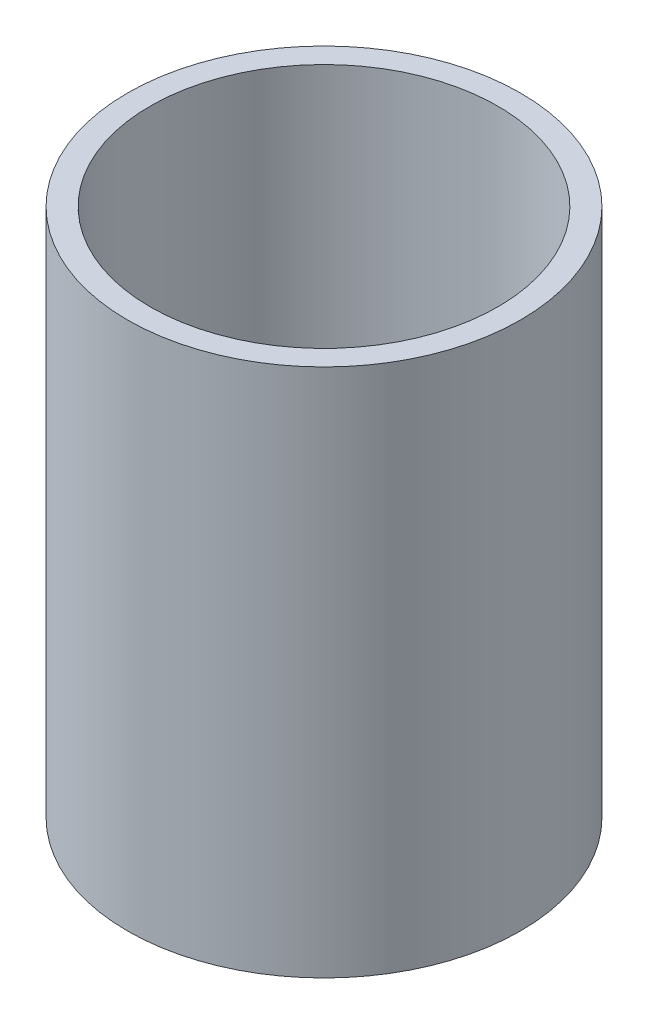
from build123d import *

# Parameters (mm, degrees)
SKETCH1_R           = 26
SKETCH1_R_2         = 23
BOSS_EXTRUDE1_DEPTH = 70


with BuildPart() as part:
    # Sketch1 → Boss-Extrude1 (new body)
    with BuildSketch(Plane(origin=(0, 0, 0), x_dir=(1, 0, 0), z_dir=(0, 1, 0))):
        with Locations(Location((0, 0, 0), (0, 0, 270))):
            Circle(SKETCH1_R)
        with Locations(Location((0, 0, 0), (0, 0, 270))):
            Circle(SKETCH1_R_2, mode=Mode.SUBTRACT)
    extrude(amount=BOSS_EXTRUDE1_DEPTH)


solid = part.part
